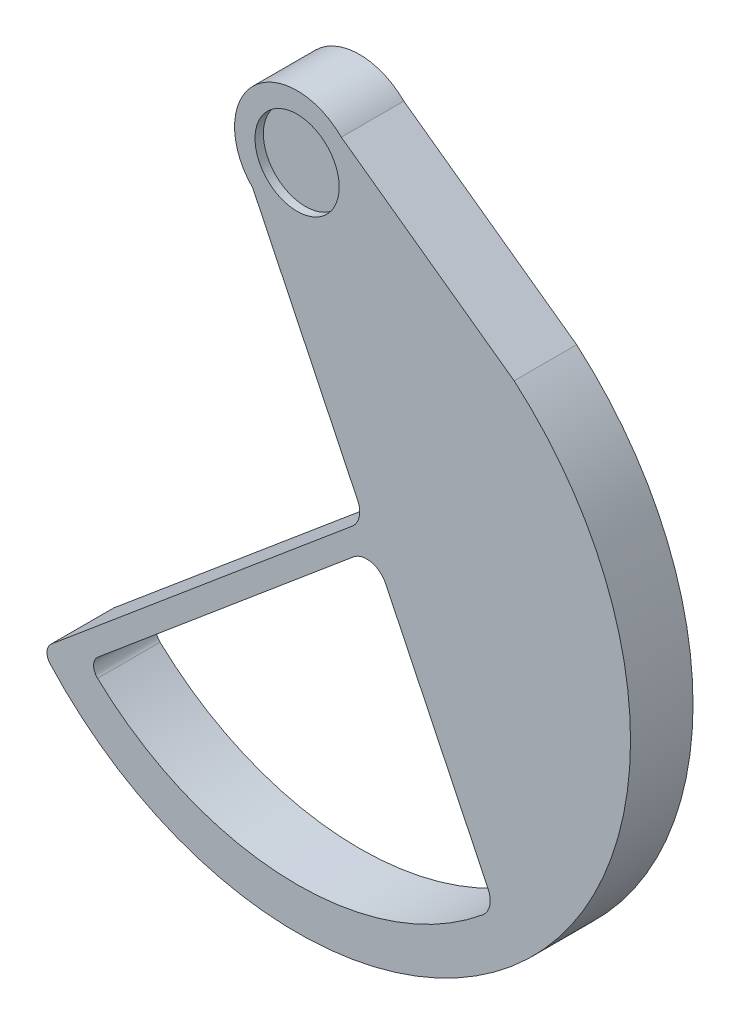
from build123d import *

# Parameters (mm, degrees)
EXTRUDE_1_DEPTH     = 15
SKETCH_5_R          = 10.1
CUT_EXTRUDE_2_DEPTH = 2


with BuildPart() as part:
    # ｽｹｯﾁ4 → ﾎﾞｽ - 押し出し1 (new body)
    with BuildSketch(Plane.XY):
        with BuildLine():
            Line((-53.623111018, -124.995132678), (-58.940636287, -129.45706617))
            ThreePointArc((-58.940636287, -129.45706617), (-60.005384698, -131.552012131), (-59.233530865, -133.771635843))
            ThreePointArc((-59.233530865, -133.771635843), (57.362306223, -135.763481103), (52.076178918, -19.270504783))
            Line((52.076178918, -19.270504783), (10.606601718, 10.606601718))
            ThreePointArc((10.606601718, 10.606601718), (-10.606601718, 10.606601718), (-10.606601718, -10.606601718))
            Line((-10.606601718, -10.606601718), (14.536280154, -62.889638219))
            ThreePointArc((14.536280154, -62.889638219), (14.918089499, -66.109676181), (13.244185189, -68.886809092))
            Line((13.244185189, -68.886809092), (-53.623111018, -124.995132678))
        make_face()
        with BuildLine():
            Line((21.232400696, -76.813798404), (45.844843506, -127.993820346))
            ThreePointArc((45.844843506, -127.993820346), (46.221944165, -131.235480845), (44.518718993, -134.019289696))
            ThreePointArc((44.518718993, -134.019289696), (-2.231208213, -149.964431749), (-47.870174388, -131.072951785))
            ThreePointArc((-47.870174388, -131.072951785), (-48.817477846, -128.802229421), (-47.747678417, -126.586582094))
            Line((-47.747678417, -126.586582094), (13.511229465, -75.151532228))
            ThreePointArc((13.511229465, -75.151532228), (17.77869109, -74.092739753), (21.232400696, -76.813798404))
        make_face(mode=Mode.SUBTRACT)
    extrude(amount=EXTRUDE_1_DEPTH)

    # ｽｹｯﾁ5 → ｶｯﾄ - 押し出し2 (cut)
    with BuildSketch(Plane.XY.offset(15)):
        Circle(SKETCH_5_R)
    extrude(amount=-CUT_EXTRUDE_2_DEPTH, mode=Mode.SUBTRACT)


solid = part.part
